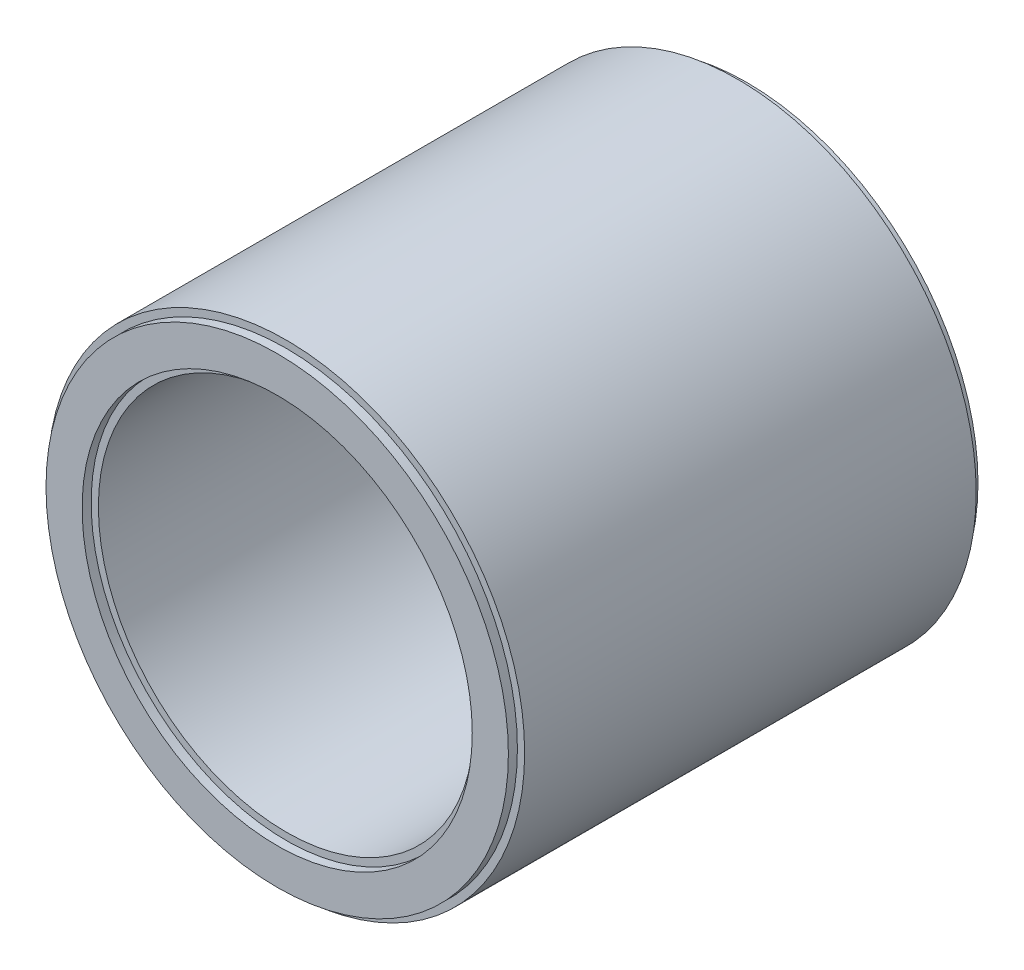
from build123d import *


with BuildPart() as part:
    # Esquisse2 → Révolution1 (revolve)
    with BuildSketch(Plane(origin=(0, 0, 0), x_dir=(0, 0, -1), z_dir=(1, 0, 0)), mode=Mode.PRIVATE) as r_volution1_sk:
        Polygon((-6.5, 6.4), (-6.25, 6.4), (-6.25, 6.6), (6.25, 6.6), (6.25, 6.4), (6.5, 6.4), (6.5, 5.4), (6.25, 5.4), (6.25, 5.2), (-6.25, 5.2), (-6.25, 5.4), (-6.5, 5.4), align=None)
    revolve(r_volution1_sk.sketch.rotate(Axis((0, 0, 6.88356419), (0, 0, -1)), 90), axis=Axis((0, 0, 6.88356419), (0, 0, -1)))


solid = part.part
